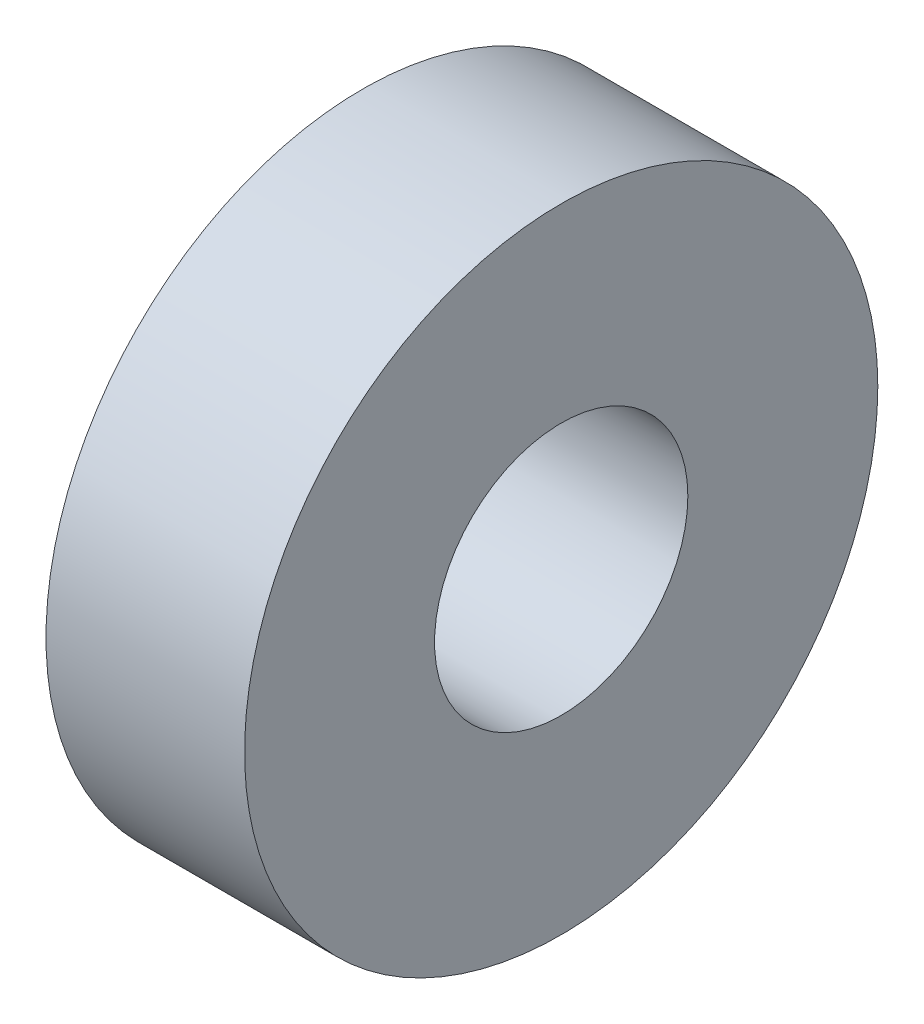
from build123d import *

# Parameters (mm, degrees)
SKETCH1_R           = 7.9375
SKETCH1_R_2         = 3.175
BOSS_EXTRUDE1_DEPTH = 2.4892


with BuildPart() as part:
    # Sketch1 → Boss-Extrude1 (new, symmetric)
    with BuildSketch(Plane(origin=(0, 0, 0), x_dir=(0, 0, -1), z_dir=(1, 0, 0))):
        Circle(SKETCH1_R)
        Circle(SKETCH1_R_2, mode=Mode.SUBTRACT)
    extrude(amount=BOSS_EXTRUDE1_DEPTH, both=True)


solid = part.part
